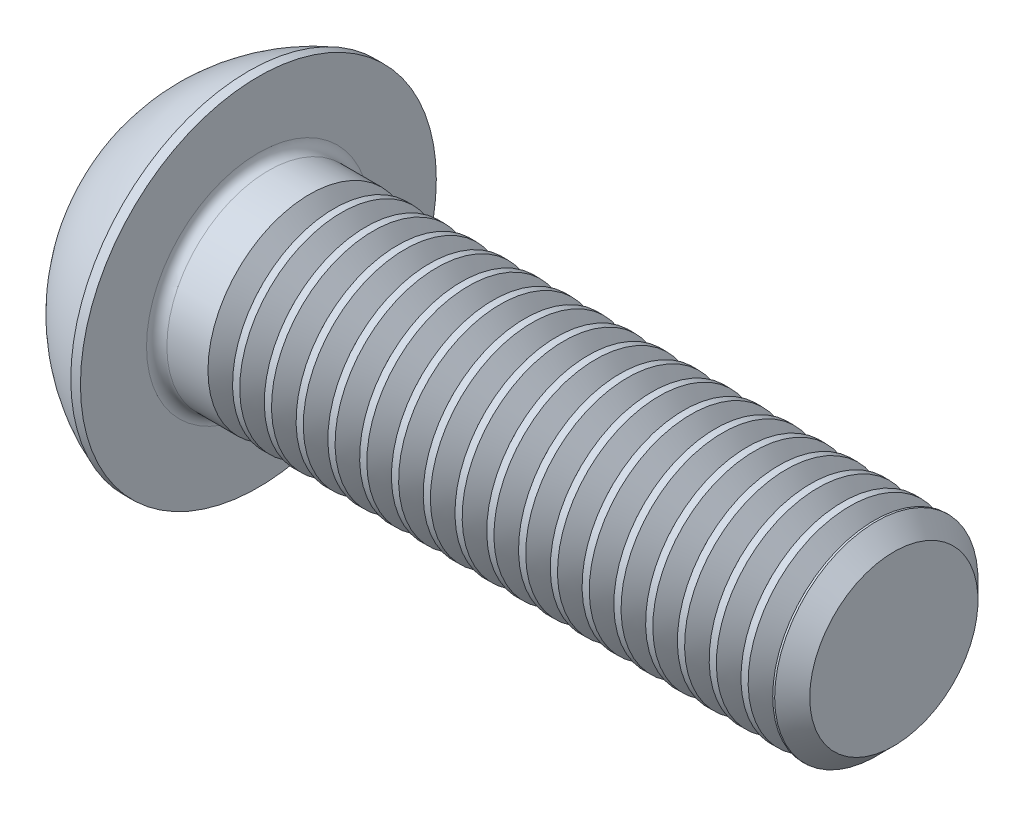
from build123d import *

# Parameters (mm, degrees)
FILLET1_R       = 0.4
HEX_2_DEPTH     = 2.6
THDSCHPAT_COUNT = 18
THDSCHPAT_PITCH = 1.25


with BuildPart() as part:
    # BodySke → BaseBody (revolve)
    with BuildSketch(Plane.XY, mode=Mode.PRIVATE) as basebody_sk:
        with BuildLine():
            Line((29.4, 0), (29.4, 3.3095))
            Line((29.4, 3.3095), (28.7095, 4))
            Line((28.7095, 4), (4.4, 4))
            Line((4.4, 4), (4.4, 7))
            Line((4.4, 7), (4.02, 7))
            ThreePointArc((4.02, 7), (1.686451133, 5.621618984), (0, 3.5))
            Line((0, 3.5), (0, 0))
            Line((0, 0), (29.4, 0))
        make_face()
    revolve(basebody_sk.sketch.rotate(Axis((0, 0, 0), (1, 0, 0)), 90), axis=Axis((0, 0, 0), (1, 0, 0)))

    # Fillet1
    fillet1_edges = [part.edges().sort_by_distance(p)[0] for p in [
        (4.4, 0, -4),
    ]]
    fillet(fillet1_edges, radius=FILLET1_R)

    # Sketch2 → PreBroach (revolve, cut)
    with BuildSketch(Plane.XY, mode=Mode.PRIVATE) as prebroach_sk:
        Polygon((0, 2.5), (2.6, 2.5), (4.043375673, 0), (0, 0), align=None)
    revolve(prebroach_sk.sketch.rotate(Axis((0, 0, 0), (1, 0, 0)), 90), axis=Axis((0, 0, 0), (1, 0, 0)), mode=Mode.SUBTRACT)

    # Sketch3 → Hex 2 (cut)
    with BuildSketch(Plane(origin=(0, 0, 0), x_dir=(0, 0, -1), z_dir=(1, 0, 0))):
        Polygon((-2.5, -1.443375673), (-2.5, 1.443375673), (0, 2.886751346), (2.5, 1.443375673), (2.5, -1.443375673), (0, -2.886751346), align=None)
    extrude(amount=HEX_2_DEPTH, mode=Mode.SUBTRACT)

    # ThdSchSke → ThreadSchematic (revolve, cut)
    with BuildSketch(Plane.XY, mode=Mode.PRIVATE) as threadschematic_sk:
        Polygon((6.9, -3.3095), (6.416506695, -4), (6.416506695, -5), (7.383493305, -5), (7.383493305, -4), align=None)
    threadschematic = revolve(threadschematic_sk.sketch.rotate(Axis((-3.175, 0, 0), (1, 0, 0)), 270), axis=Axis((-3.175, 0, 0), (1, 0, 0)), mode=Mode.SUBTRACT)

    # ThdSchPat: ThreadSchematic ×18
    with Locations(*[(i * THDSCHPAT_PITCH, 0, 0) for i in range(1, THDSCHPAT_COUNT)]):
        add(threadschematic, mode=Mode.SUBTRACT)


solid = part.part
